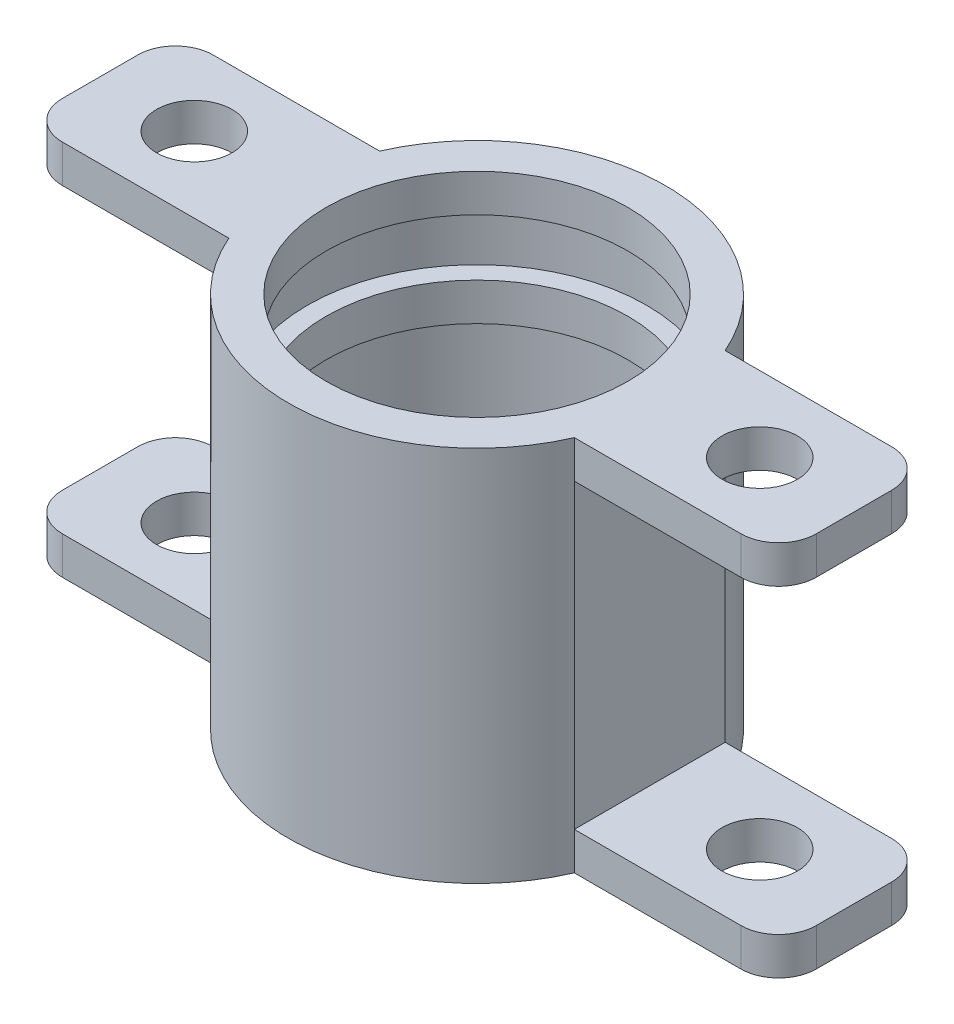
from build123d import *

# Parameters (mm, degrees)
SKETCH1_R           = 40
BOSS_EXTRUDE1_DEPTH = 100
SKETCH3_W           = 54.17424305
SKETCH3_H           = 80
CUT_EXTRUDE1_DEPTH  = 158.797338381
HOLE1_D             = 20
FILLET1_R           = 10
SKETCH6_W           = 45
SKETCH6_H           = 15
SKETCH6_H_2         = 30


with BuildPart() as part:
    # Sketch1 → Boss-Extrude1 (new body)
    with BuildSketch(Plane(origin=(0, 0, 0), x_dir=(1, 0, 0), z_dir=(0, 1, 0))):
        with BuildLine():
            Line((45.82575695, 20), (100, 20))
            Line((100, 20), (100, -20))
            Line((100, -20), (45.82575695, -20))
            ThreePointArc((45.82575695, -20), (0, -50), (-45.82575695, -20))
            Line((-45.82575695, -20), (-100, -20))
            Line((-100, -20), (-100, 20))
            Line((-100, 20), (-45.82575695, 20))
            ThreePointArc((-45.82575695, 20), (0, 50), (45.82575695, 20))
        make_face()
        with Locations(Location((0, 0, 0), (0, 0, 270))):
            Circle(SKETCH1_R, mode=Mode.SUBTRACT)
    extrude(amount=BOSS_EXTRUDE1_DEPTH)

    # Sketch3 → Cut-Extrude1 (cut, symmetric)
    with BuildSketch(Plane.XY.offset(20)):
        with Locations((72.912878475, 50)):
            Rectangle(SKETCH3_W, SKETCH3_H)
    cut_extrude1 = extrude(amount=CUT_EXTRUDE1_DEPTH, both=True, mode=Mode.SUBTRACT)

    # Mirror1: Cut-Extrude1 across plane
    add(cut_extrude1.mirror(Plane(origin=(0, 0, 0), x_dir=(0, 0, 1), z_dir=(1, 0, 0))), mode=Mode.SUBTRACT)

    # Hole1 (through all)
    with Locations(Plane(origin=(0, 100, 0), x_dir=(1, 0, 0), z_dir=(0, 1, 0))):
        with Locations((-75, 0), (75, 0)):
            Hole(HOLE1_D / 2)

    # Fillet1
    fillet1_edges = [part.edges().sort_by_distance(p)[0] for p in [
        (100, 95, 20),
        (-100, 95, 20),
        (-100, 95, -20),
        (100, 95, -20),
        (100, 5, 20),
        (100, 5, -20),
        (-100, 5, 20),
        (-100, 5, -20),
    ]]
    fillet(fillet1_edges, radius=FILLET1_R)

    # Sketch6 → Cut-Revolve1 (revolve, cut)
    with BuildSketch(Plane.XY, mode=Mode.PRIVATE) as cut_revolve1_sk:
        with Locations((22.5, 82.5)):
            Rectangle(SKETCH6_W, SKETCH6_H)
        with Locations((22.5, 50)):
            Rectangle(SKETCH6_W, SKETCH6_H_2)
        with Locations((22.5, 17.5)):
            Rectangle(SKETCH6_W, SKETCH6_H)
    revolve(cut_revolve1_sk.sketch.rotate(Axis((0, 0, 0), (0, 1, 0)), 90), axis=Axis((0, 0, 0), (0, 1, 0)), mode=Mode.SUBTRACT)


solid = part.part
